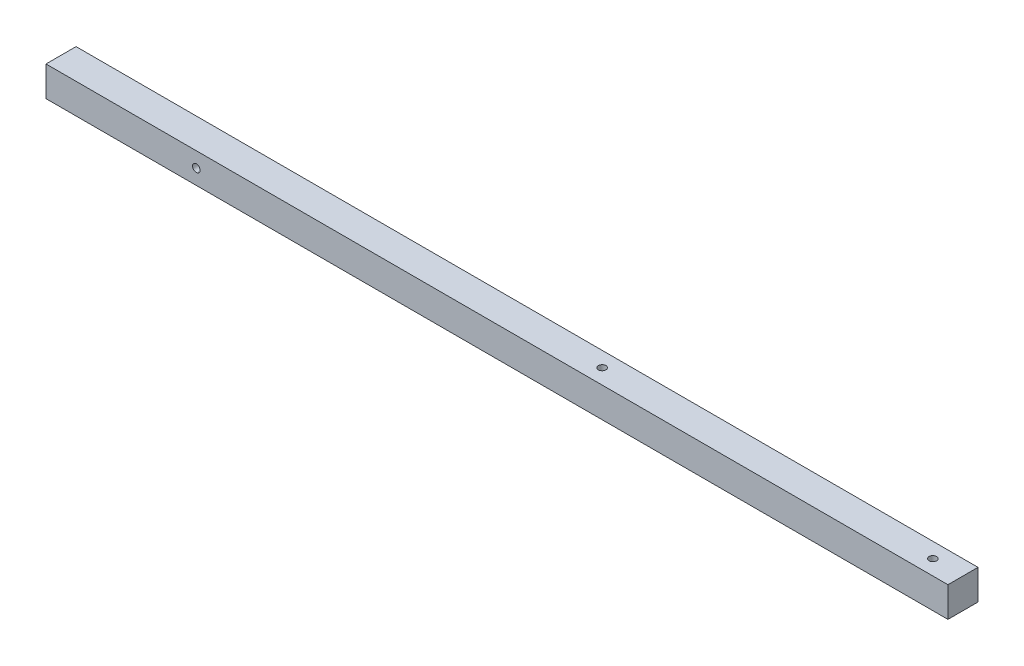
from build123d import *

# Parameters (mm, degrees)
SCHIZZO1_W                   = 1200
SCHIZZO1_H                   = 40
ESTRUSIONE_ESTRUSIONE1_DEPTH = 40
SCHIZZO2_R                   = 5
TAGLIO_ESTRUSIONE1_DEPTH     = 1202.332593414
SCHIZZO3_R                   = 5
TAGLIO_ESTRUSIONE2_DEPTH     = 1202.332593414


with BuildPart() as part:
    # Schizzo1 → Estrusione-Estrusione1 (new body)
    with BuildSketch(Plane.XY):
        with Locations((600, 20)):
            Rectangle(SCHIZZO1_W, SCHIZZO1_H)
    extrude(amount=ESTRUSIONE_ESTRUSIONE1_DEPTH)

    # Schizzo2 → Taglio-Estrusione1 (cut, through all)
    with BuildSketch(Plane.XY.offset(40)):
        with Locations((200, 20)):
            Circle(SCHIZZO2_R)
    extrude(amount=-TAGLIO_ESTRUSIONE1_DEPTH, mode=Mode.SUBTRACT)

    # Schizzo3 → Taglio-Estrusione2 (cut, through all)
    with BuildSketch(Plane(origin=(0, 40, 0), x_dir=(1, 0, 0), z_dir=(0, 1, 0))):
        with Locations(Location((1160, -20, 0), (0, 0, 180))):
            Circle(SCHIZZO3_R)
        with Locations(Location((720, -20, 0), (0, 0, 180))):
            Circle(SCHIZZO3_R)
    extrude(amount=-TAGLIO_ESTRUSIONE2_DEPTH, mode=Mode.SUBTRACT)


solid = part.part
